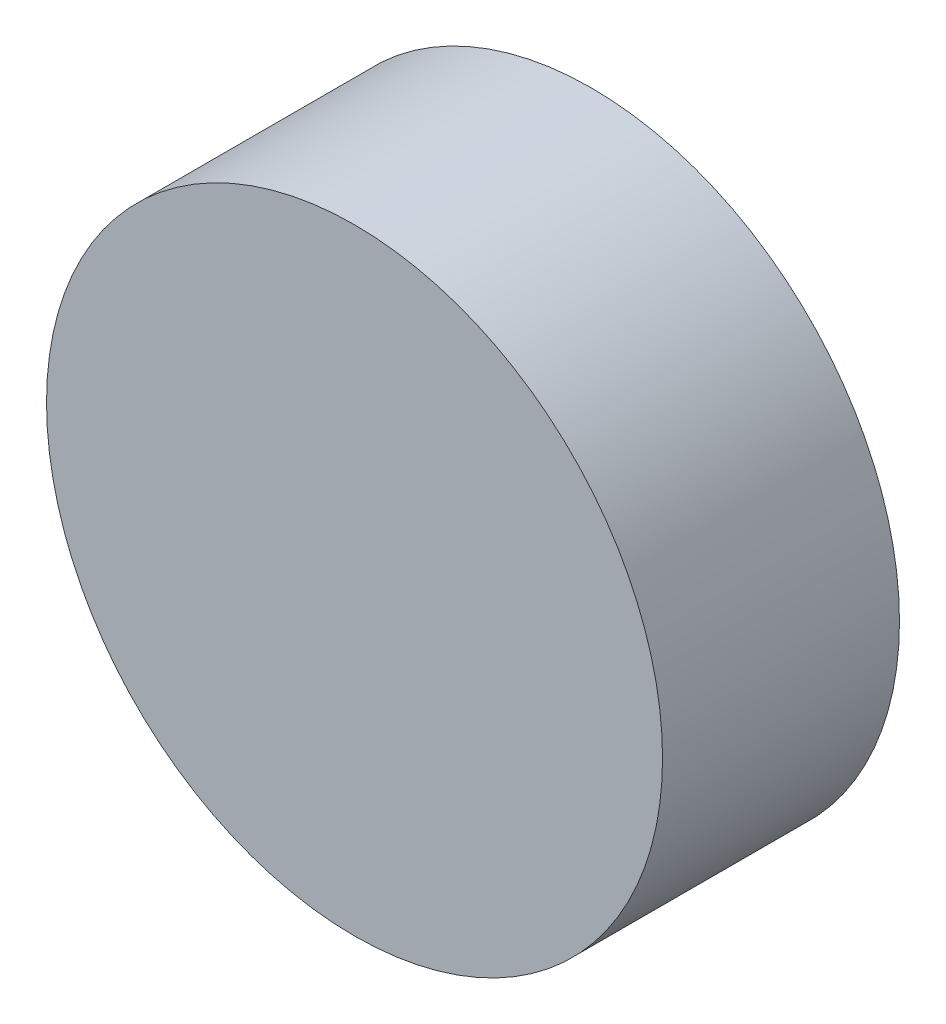
from build123d import *

# Parameters (mm, degrees)
ESQUISSE1_R        = 13
BOSS_EXTRU_1_DEPTH = 10


with BuildPart() as part:
    # Esquisse1 → Boss.-Extru.1 (new body)
    with BuildSketch(Plane.XY):
        Circle(ESQUISSE1_R)
    extrude(amount=BOSS_EXTRU_1_DEPTH)


solid = part.part
